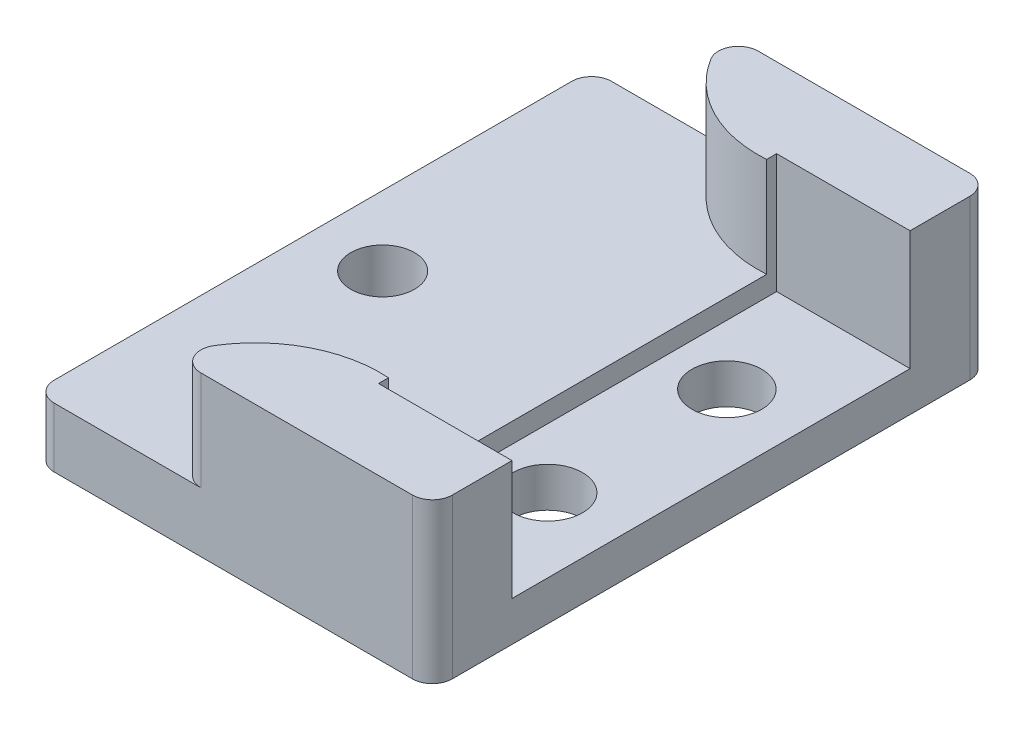
from build123d import *

# Parameters (mm, degrees)
CROQUIS2_W              = 20
CROQUIS2_H              = 28
SALIENTE_EXTRUIR1_DEPTH = 8
CROQUIS3_W              = 6.705751287
CROQUIS3_H              = 20
CORTAR_EXTRUIR1_DEPTH   = 6
CORTAR_EXTRUIR2_DEPTH   = 5
CROQUIS6_R              = 1.6
CORTAR_EXTRUIR3_DEPTH   = 3
REDONDEO1_R             = 1
SKETCH1_R               = 1.75
CUT_EXTRUDE1_DEPTH      = 24.126770256


with BuildPart() as part:
    # Croquis2 → Saliente-Extruir1 (new body)
    with BuildSketch(Plane(origin=(0, 0, 0), x_dir=(1, 0, 0), z_dir=(0, 1, 0))):
        with Locations((-0.843373494, -5.526104418)):
            Rectangle(CROQUIS2_W, CROQUIS2_H)
    extrude(amount=SALIENTE_EXTRUIR1_DEPTH)

    # Croquis3 → Cortar-Extruir1 (cut)
    with BuildSketch(Plane(origin=(0, 8, 0), x_dir=(1, 0, 0), z_dir=(0, 1, 0))):
        with Locations((5.803750863, -5.526104418)):
            Rectangle(CROQUIS3_W, CROQUIS3_H)
    extrude(amount=-CORTAR_EXTRUIR1_DEPTH, mode=Mode.SUBTRACT)

    # Croquis5 → Cortar-Extruir2 (cut)
    with BuildSketch(Plane(origin=(0, 8, 0), x_dir=(1, 0, 0), z_dir=(0, 1, 0))):
        with BuildLine():
            Line((2.450875219, -15.026104418), (2.450875219, 3.973895582))
            ThreePointArc((2.450875219, 3.973895582), (2.020425803, 3.959111389), (1.589976387, 3.973895582))
            ThreePointArc((1.589976387, 3.973895582), (-1.912953919, 5.345273007), (-4.00171373, 8.473895582))
            Line((-4.00171373, 8.473895582), (-10.843373494, 8.473895582))
            Line((-10.843373494, 8.473895582), (-10.843373494, -19.526104418))
            Line((-10.843373494, -19.526104418), (-4.00171373, -19.526104418))
            ThreePointArc((-4.00171373, -19.526104418), (-1.912953919, -16.397481842), (1.589976387, -15.026104418))
            ThreePointArc((1.589976387, -15.026104418), (2.020425803, -15.011320225), (2.450875219, -15.026104418))
        make_face()
    extrude(amount=-CORTAR_EXTRUIR2_DEPTH, mode=Mode.SUBTRACT)

    # Croquis6 → Cortar-Extruir3 (cut)
    with BuildSketch(Plane(origin=(0, 3, 0), x_dir=(1, 0, 0), z_dir=(0, 1, 0))):
        with Locations(Location((-7.343373494, -5.526104418, 0), (0, 0, 270))):
            Circle(CROQUIS6_R)
    extrude(amount=-CORTAR_EXTRUIR3_DEPTH, mode=Mode.SUBTRACT)

    # Redondeo1
    redondeo1_edges = [part.edges().sort_by_distance(p)[0] for p in [
        (-10.843373494, 1.5, -8.473895582),
        (-10.843373494, 1.5, 19.526104418),
        (-4.00171373, 5.5, 19.526104418),
        (-4.00171373, 5.5, -8.473895582),
        (9.156626506, 4, -8.473895582),
        (9.156626506, 4, 19.526104418),
    ]]
    fillet(redondeo1_edges, radius=REDONDEO1_R)

    # Sketch1 → Cut-Extrude1 (cut, through all)
    with BuildSketch(Plane(origin=(0, 2, 0), x_dir=(1, 0, 0), z_dir=(0, 1, 0))):
        with Locations(Location((5.450875219, -1.026104418, 0), (0, 0, 270))):
            Circle(SKETCH1_R)
        with Locations(Location((5.450875219, -10.026104418, 0), (0, 0, 270))):
            Circle(SKETCH1_R)
    extrude(amount=-CUT_EXTRUDE1_DEPTH, mode=Mode.SUBTRACT)


solid = part.part
